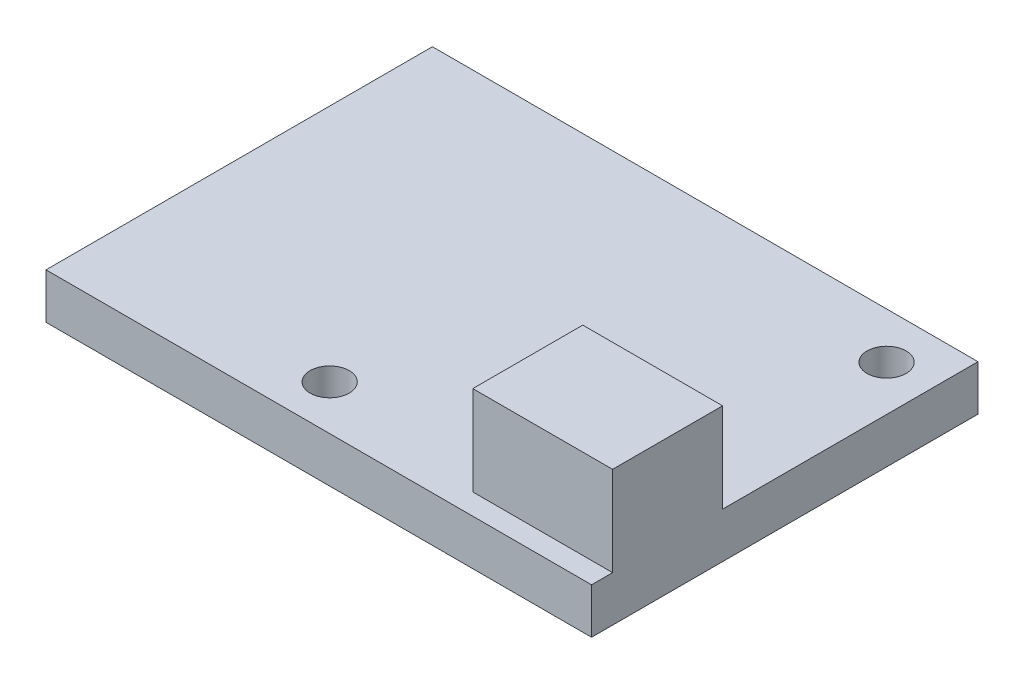
from build123d import *

# Parameters (mm, degrees)
SKETCH1_W           = 30.48
SKETCH1_H           = 21.59
BOSS_EXTRUDE1_DEPTH = 2.54
SKETCH2_R           = 1.0922
CUT_EXTRUDE1_DEPTH  = 38.438083551
SKETCH4_W           = 7.811008033
SKETCH4_H           = 6.144185349
BOSS_EXTRUDE2_DEPTH = 5


with BuildPart() as part:
    # Sketch1 → Boss-Extrude1 (new body)
    with BuildSketch(Plane(origin=(0, 0, 0), x_dir=(1, 0, 0), z_dir=(0, 1, 0))):
        with Locations((15.24, 10.795)):
            Rectangle(SKETCH1_W, SKETCH1_H)
    extrude(amount=BOSS_EXTRUDE1_DEPTH)

    # Sketch2 → Cut-Extrude1 (cut, through all)
    with BuildSketch(Plane(origin=(0, 2.54, 0), x_dir=(1, 0, 0), z_dir=(0, 1, 0))):
        with Locations(Location((27.950511617, 19.012165286, 0), (0, 0, 270))):
            Circle(SKETCH2_R)
        with Locations(Location((13.345511617, 2.502165286, 0), (0, 0, 270))):
            Circle(SKETCH2_R)
    extrude(amount=-CUT_EXTRUDE1_DEPTH, mode=Mode.SUBTRACT)

    # Sketch4 → Boss-Extrude2 (add)
    with BuildSketch(Plane(origin=(0, 2.54, 0), x_dir=(1, 0, 0), z_dir=(0, 1, 0))):
        with Locations((26.574495984, 4.247718085)):
            Rectangle(SKETCH4_W, SKETCH4_H)
    extrude(amount=BOSS_EXTRUDE2_DEPTH)


solid = part.part
